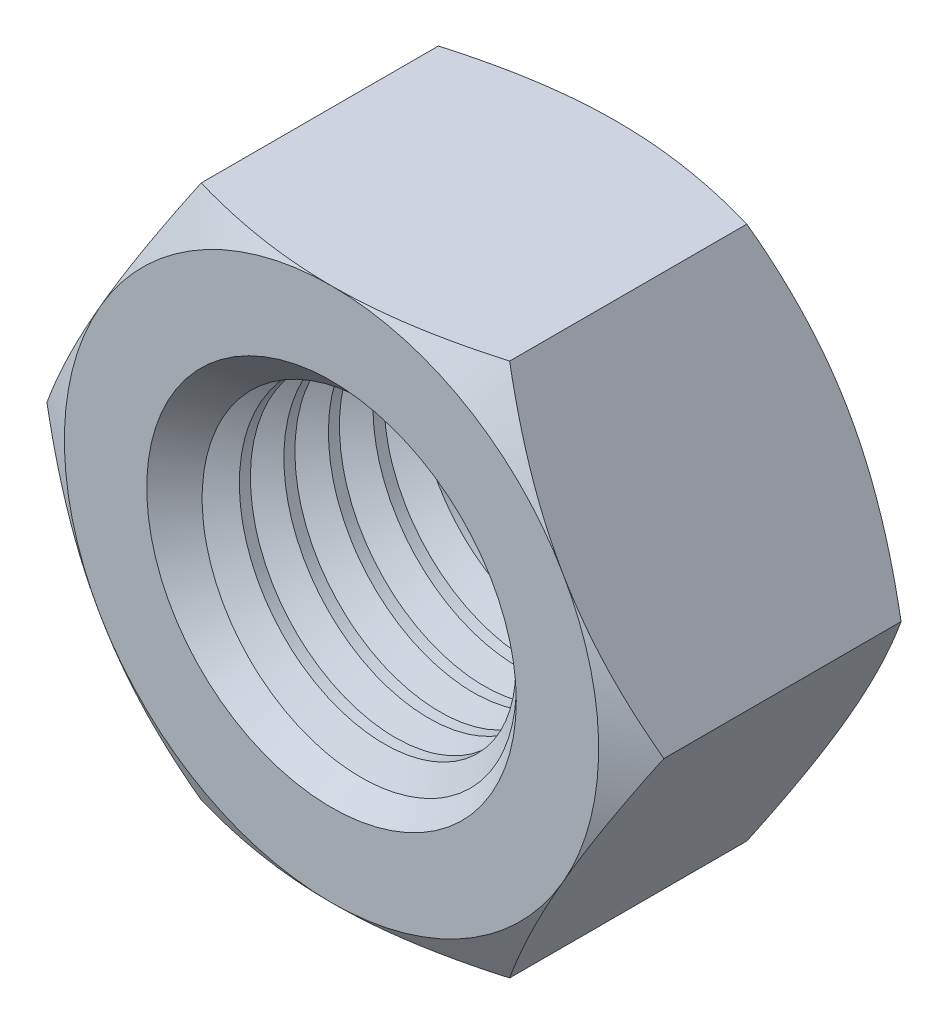
from build123d import *

# Parameters (mm, degrees)
Y_KSEKLIK_EKSTR_ZYON1_DEPTH = 16
IZIM2_OUTSIDE_W             = 101.77599999999998
IZIM2_OUTSIDE_H             = 97.134
IZIM2_OUTSIDE_R             = 15.000000000000014
KES_EKSTR_ZYON1_DEPTH       = 16
KES_EKSTR_ZYON1_DRAFT       = -60.000000000000135
IZIM3_OUTSIDE_W             = 101.77599999999998
IZIM3_OUTSIDE_H             = 97.134
IZIM3_OUTSIDE_R             = 15.00000000000002
KES_EKSTR_ZYON2_DEPTH       = 16
KES_EKSTR_ZYON2_DRAFT       = -60.000000000000135
IZIM4_R                     = 8.375
KES_EKSTR_ZYON3_DEPTH       = 16
PAH1_SIZE                   = 2
KES_S_P_R1_PITCH            = 2.4999999999999933
KES_S_P_R1_HEIGHT           = 19.00000000000002
KES_S_P_R1_RADIUS           = 8.375
KES_S_P_R1_START_ANGLE      = -3.8794e-13


with BuildPart() as part:
    # Çizim1 → Yükseklik-Ekstrüzyon1 (new body)
    with BuildSketch(Plane.XY):
        Polygon((17.32050807568876, 5.3e-16), (8.660254037844348, 15.000000000000014), (-8.660254037844403, 15.000000000000014), (-17.320508075688792, 3.11e-15), (-8.660254037844403, -14.999999999999993), (8.660254037844387, -14.999999999999993), align=None)
    extrude(amount=Y_KSEKLIK_EKSTR_ZYON1_DEPTH)


with BuildPart() as kes_ekstr_zyon1_tool:
    # Çizim2 outside → Kes-Ekstrüzyon1 (with draft: the straight prism first)
    with BuildSketch(Plane.XY.offset(16)):
        Rectangle(IZIM2_OUTSIDE_W, IZIM2_OUTSIDE_H)
        Circle(IZIM2_OUTSIDE_R, mode=Mode.SUBTRACT)
    extrude(amount=-KES_EKSTR_ZYON1_DEPTH)
    # Kes-Ekstrüzyon1: the draft: its side faces are tilted about the plane it starts from
    kes_ekstr_zyon1_sides = [kes_ekstr_zyon1_tool.faces().sort_by_distance(p)[0] for p in [
        (0, -48.567, 8),
        (50.888, 0, 8),
        (0, 48.567, 8),
        (-50.888, 0, 8),
        (-15, 0, 8),
    ]]
    draft(kes_ekstr_zyon1_sides, Plane.XY.offset(16), KES_EKSTR_ZYON1_DRAFT)


with BuildPart() as part_1:
    add(part.part)

    # Kes-Ekstrüzyon1: cut by kes_ekstr_zyon1_tool
    add(kes_ekstr_zyon1_tool.part, mode=Mode.SUBTRACT)


with BuildPart() as kes_ekstr_zyon2_tool:
    # Çizim3 outside → Kes-Ekstrüzyon2 (with draft: the straight prism first)
    with BuildSketch(Plane(origin=(0, 0, 0), x_dir=(-1, 0, 0), z_dir=(0, 0, -1))):
        Rectangle(IZIM3_OUTSIDE_W, IZIM3_OUTSIDE_H)
        Circle(IZIM3_OUTSIDE_R, mode=Mode.SUBTRACT)
    extrude(amount=-KES_EKSTR_ZYON2_DEPTH)
    # Kes-Ekstrüzyon2: the draft: its side faces are tilted about the plane it starts from
    kes_ekstr_zyon2_sides = [kes_ekstr_zyon2_tool.faces().sort_by_distance(p)[0] for p in [
        (0, -48.567, 8),
        (-50.888, 0, 8),
        (0, 48.567, 8),
        (50.888, 0, 8),
        (15, 0, 8),
    ]]
    draft(kes_ekstr_zyon2_sides, Plane(origin=(0, 0, 0), x_dir=(-1, 0, 0), z_dir=(0, 0, -1)), KES_EKSTR_ZYON2_DRAFT)


with BuildPart() as part_2:
    add(part_1.part)

    # Kes-Ekstrüzyon2: cut by kes_ekstr_zyon2_tool
    add(kes_ekstr_zyon2_tool.part, mode=Mode.SUBTRACT)

    # Çizim4 → Kes-Ekstrüzyon3 (cut)
    with BuildSketch(Plane(origin=(0, 0, 0), x_dir=(-1, 0, 0), z_dir=(0, 0, -1))):
        Circle(IZIM4_R)
    extrude(amount=-KES_EKSTR_ZYON3_DEPTH, mode=Mode.SUBTRACT)

    # Pah1
    pah1_edges = [part_2.edges().sort_by_distance(p)[0] for p in [
        (8.375, 1.03e-15, 16),
        (8.375, 1.03e-15, 0),
    ]]
    chamfer(pah1_edges, length=PAH1_SIZE)

    # Kes-Süpür1: sweep along a helix
    with BuildLine() as kes_s_p_r1_path:
        add(Helix(KES_S_P_R1_PITCH, KES_S_P_R1_HEIGHT, KES_S_P_R1_RADIUS, center=(0, 0, 0), direction=(0, 0, 1), mode=Mode.PRIVATE).rotate(Axis((0, 0, 0), (0, 0, 1)), KES_S_P_R1_START_ANGLE))
    # Çizim6 → Kes-Süpür1 (sweep, cut)
    with BuildSketch(Plane(origin=(-6.775517327889646, -4.922701487950125, 19.000000000000025), x_dir=(-0.8094977144159604, -0.5861132803253658, 0.03441907874385192), z_dir=(0.5871230282958899, -0.8081055212385817, 0.04745541263527056))):
        Polygon((-0.49885715507969053, -1.2262095002055726), (-0.49885715507969075, 1.2262095002055724), (1.6250000000000002, 0), align=None)
    sweep(path=kes_s_p_r1_path.line, is_frenet=True, mode=Mode.SUBTRACT)


solid = part_2.part
